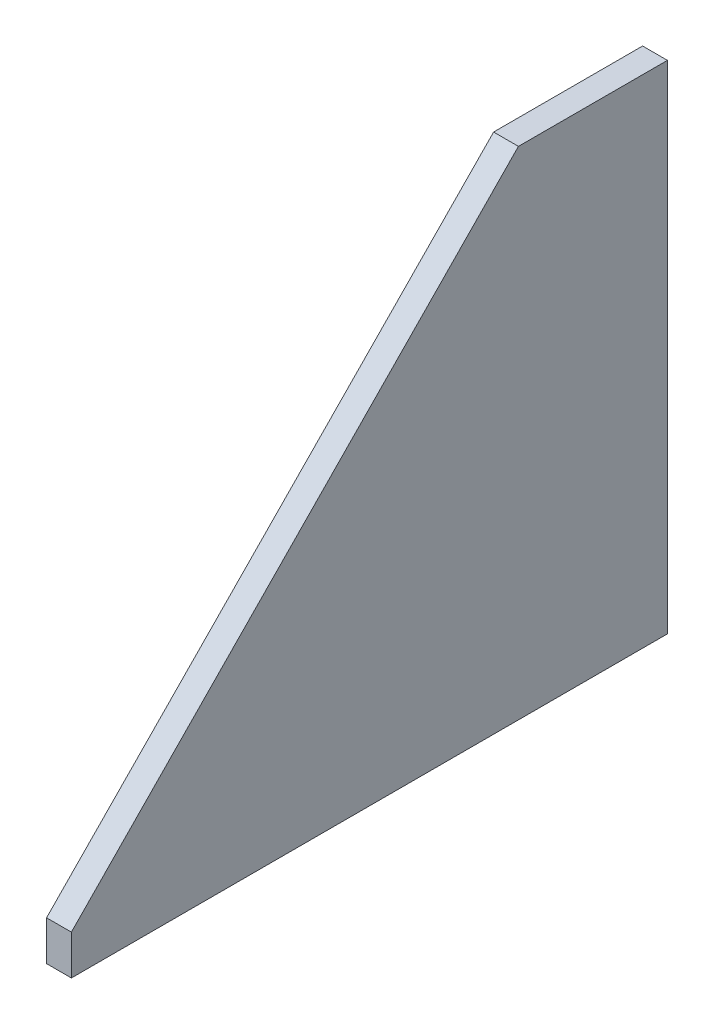
from build123d import *

# Parameters (mm, degrees)
BOSS_EXTRUDE1_DEPTH = 2.5


with BuildPart() as part:
    # Sketch1 → Boss-Extrude1 (new, symmetric)
    with BuildSketch(Plane(origin=(0, 0, 0), x_dir=(0, 0, -1), z_dir=(1, 0, 0))):
        Polygon((0, 0), (120, 0), (120, 100), (90, 100), (0, 8), align=None)
    extrude(amount=BOSS_EXTRUDE1_DEPTH, both=True)


solid = part.part
